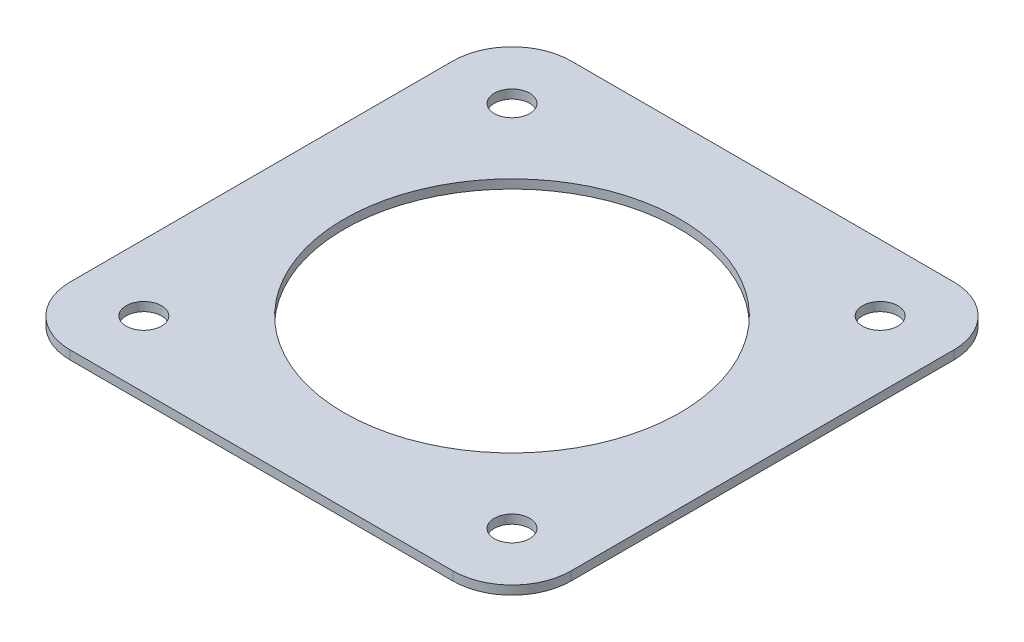
from build123d import *

# Parameters (mm, degrees)
SKETCH_1_R      = 6
SKETCH_1_R_2    = 57
EXTRUDE_1_DEPTH = 3


with BuildPart() as part:
    # Эскиз1 → Бобышка-Вытянуть1 (new body)
    with BuildSketch(Plane(origin=(0, 0, 0), x_dir=(1, 0, 0), z_dir=(0, 1, 0))):
        with BuildLine():
            Line((65, -85), (-65, -85))
            ThreePointArc((-65, -85), (-79.142135624, -79.142135624), (-85, -65))
            Line((-85, -65), (-85, 65))
            ThreePointArc((-85, 65), (-79.142135624, 79.142135624), (-65, 85))
            Line((-65, 85), (65, 85))
            ThreePointArc((65, 85), (79.142135624, 79.142135624), (85, 65))
            Line((85, 65), (85, -65))
            ThreePointArc((85, -65), (79.142135624, -79.142135624), (65, -85))
        make_face()
        with Locations(Location((-62.5, -62.5, 0), (0, 0, 270))):
            Circle(SKETCH_1_R, mode=Mode.SUBTRACT)
        with Locations(Location((-62.5, 62.5, 0), (0, 0, 270))):
            Circle(SKETCH_1_R, mode=Mode.SUBTRACT)
        with Locations(Location((62.5, 62.5, 0), (0, 0, 270))):
            Circle(SKETCH_1_R, mode=Mode.SUBTRACT)
        with Locations(Location((62.5, -62.5, 0), (0, 0, 270))):
            Circle(SKETCH_1_R, mode=Mode.SUBTRACT)
        with Locations(Location((0, 0, 0), (0, 0, 270))):
            Circle(SKETCH_1_R_2, mode=Mode.SUBTRACT)
    extrude(amount=EXTRUDE_1_DEPTH)


solid = part.part
